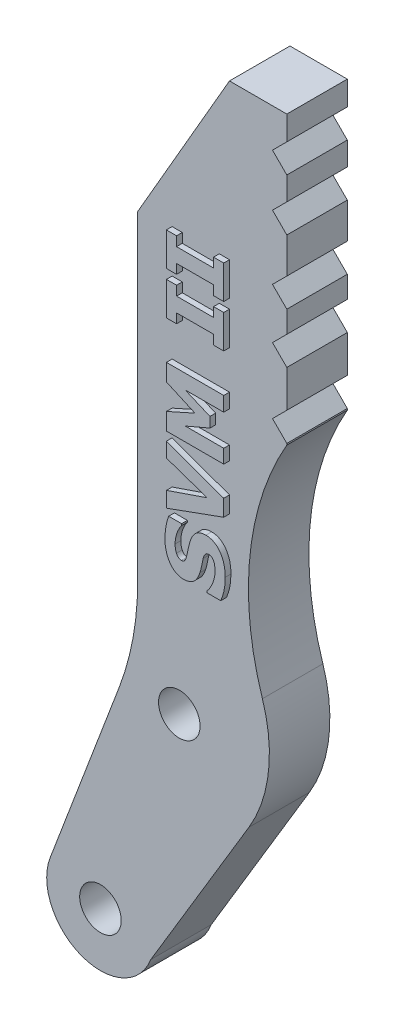
from build123d import *

# Parameters (mm, degrees)
BOSS_EXTRUDE1_DEPTH      = 5.08
BOSS_EXTRUDE1_DEPTH_BACK = 0.278409343
SKETCH1_R                = 1.8415
CUT_EXTRUDE1_DEPTH       = 72.358313291
CUT_EXTRUDE1_DEPTH_BACK  = 72.358313291
FILLET2_R                = 12.7
BOSS_EXTRUDE2_DEPTH      = 0.508
CUT_EXTRUDE3_DEPTH       = 72.358313411
CUT_EXTRUDE3_DEPTH_BACK  = 72.358313411
FILLET3_R                = 25.4


with BuildPart() as part:
    # Sketch1 → Boss-Extrude1 (new, two sides: drawn at the far end of the back side and taken through both)
    with BuildSketch(Plane.XY.offset(-BOSS_EXTRUDE1_DEPTH_BACK)):
        with BuildLine():
            Line((-1.208443772, 47.324573258), (-1.208443772, 10.242675014))
            Line((-1.208443772, 10.242675014), (-4.452925719, 1.68904079))
            ThreePointArc((-4.452925719, 1.68904079), (-1.68904079, -4.452925719), (4.452925719, -1.68904079))
            Line((4.452925719, -1.68904079), (16.51, 18.415))
            ThreePointArc((16.51, 18.415), (13.107045256, 31.115), (16.51, 43.815))
            Line((16.51, 43.815), (16.51, 69.215))
            Line((16.51, 69.215), (11.43, 69.215))
            Line((11.43, 69.215), (-1.208443772, 47.324573258))
        make_face()
        Circle(SKETCH1_R, mode=Mode.SUBTRACT)
        with Locations((6.985, 18.415)):
            Circle(SKETCH1_R, mode=Mode.SUBTRACT)
    extrude(amount=BOSS_EXTRUDE1_DEPTH + BOSS_EXTRUDE1_DEPTH_BACK)

    # Sketch2 → Cut-Extrude1 (cut, two sides: drawn at the far end of the back side and taken through both)
    with BuildSketch(Plane(origin=(0, 0, -0.278409343), x_dir=(-1, 0, 0), z_dir=(0, 0, -1)).offset(-CUT_EXTRUDE1_DEPTH_BACK)):
        Polygon((-16.51, 64.538831006), (-15.24, 65.808831006), (-16.51, 67.078831006), align=None)
        Polygon((-16.51, 62.474619372), (-16.51, 59.934619372), (-15.24, 61.204619372), align=None)
        Polygon((-15.24, 55.512601826), (-16.51, 56.782601826), (-16.51, 54.242601826), align=None)
        Polygon((-16.51, 49.774619372), (-15.24, 51.044619372), (-16.51, 52.314619372), align=None)
        Polygon((-16.51, 43.946372647), (-15.24, 45.216372647), (-16.51, 46.486372647), align=None)
    extrude(amount=CUT_EXTRUDE1_DEPTH + CUT_EXTRUDE1_DEPTH_BACK, mode=Mode.SUBTRACT)

    # Fillet2
    fillet2_edges = [part.edges().sort_by_distance(p)[0] for p in [
        (16.51, 18.415, 2.400795328),
        (-1.208443772, 10.242675014, 2.400795328),
    ]]
    fillet(fillet2_edges, radius=FILLET2_R)

    # Sketch3 → Boss-Extrude2 (add)
    with BuildSketch(Plane.XY.offset(5.08)):
        Polygon((11.43, 55.499774955), (11.43, 52.541800271), (10.529746835, 52.541800271), (10.529746835, 53.377749638), (7.250253165, 53.377749638), (7.250253165, 52.541800271), (6.35, 52.541800271), (6.35, 55.499774955), (7.250253165, 55.499774955), (7.250253165, 54.663825588), (10.529746835, 54.663825588), (10.529746835, 55.499774955), align=None)
        Polygon((11.43, 51.705850904), (11.43, 48.747876221), (10.529746835, 48.747876221), (10.529746835, 49.583825588), (7.250253165, 49.583825588), (7.250253165, 48.747876221), (6.35, 48.747876221), (6.35, 51.705850904), (7.250253165, 51.705850904), (7.250253165, 50.869901537), (10.529746835, 50.869901537), (10.529746835, 51.705850904), align=None)
        Polygon((11.43, 45.339774955), (11.43, 44.053699005), (8.016875, 44.053699005), (10.208227848, 43.119284449), (10.208227848, 42.223050271), (8.016875, 41.288635714), (11.43, 41.288635714), (11.43, 40.066863562), (6.35, 40.066863562), (6.35, 41.572979069), (8.879952532, 42.706333499), (6.35, 43.836673689), (6.35, 45.339774955), align=None)
        Polygon((6.35, 39.295217993), (11.43, 37.452512297), (11.43, 35.993619892), (6.35, 34.150914195), (6.35, 35.519379385), (9.96306962, 36.757227486), (6.35, 37.995075588), align=None)
        with BuildLine():
            add(Edge.make_bspline(
                [(9.846518987, 33.829395208), (9.908602777, 33.827540047), (10.030514618, 33.82389713), (10.208713746, 33.792945029), (10.37755686, 33.742396865), (10.538147756, 33.672998198), (10.688740624, 33.581082418), (10.830778166, 33.470272153), (10.963579449, 33.338826792), (11.085932635, 33.18864266), (11.197929538, 33.021963025), (11.293997733, 32.838956956), (11.376625705, 32.642412012), (11.444249411, 32.431368692), (11.494587867, 32.205538816), (11.531330238, 31.965874182), (11.555385035, 31.712212514), (11.557515563, 31.538294184), (11.558607595, 31.449149955)],
                knots=[0, 0, 0, 0, 0.907462679, 1.781953809, 2.635804048, 3.480274448, 4.332887508, 5.208817748, 6.109340518, 7.059474472, 8.037577805, 9.041105121, 10.077237313, 11.152245627, 12.27748741, 13.457227022, 14.696666784, 16, 16, 16, 16], degree=3))
            add(Edge.make_bspline(
                [(11.558607595, 31.449149955), (11.557222534, 31.346636342), (11.554540117, 31.148100486), (11.534963162, 30.860188018), (11.500015319, 30.592803934), (11.451421038, 30.343998376), (11.390294148, 30.110099901), (11.324729444, 29.884886008), (11.250328749, 29.667396357), (11.194441826, 29.526523276), (11.166756329, 29.45673698)],
                knots=[0, 0, 0, 0, 1.203182053, 2.33017619, 3.384818652, 4.366208123, 5.30340534, 6.221361684, 7.118890722, 8, 8, 8, 8], degree=3))
            Line((11.166756329, 29.45673698), (9.951012658, 29.45673698))
            Line((9.951012658, 29.45673698), (9.951012658, 29.601420524))
            add(Edge.make_bspline(
                [(9.951012658, 29.601420524), (10.005925562, 29.670791142), (10.115428983, 29.809125109), (10.256061384, 30.034014578), (10.37661031, 30.270692385), (10.477327542, 30.516482783), (10.557368735, 30.765472302), (10.614615544, 31.01282093), (10.652175252, 31.255085257), (10.656318563, 31.415528), (10.65835443, 31.494363562)],
                knots=[0, 0, 0, 0, 1.030738938, 2.055426519, 3.085610749, 4.123842265, 5.148648843, 6.130724483, 7.081507926, 8, 8, 8, 8], degree=3))
            add(Edge.make_bspline(
                [(10.65835443, 31.494363562), (10.658286547, 31.516143707), (10.658141214, 31.562773303), (10.652039486, 31.637076265), (10.645415149, 31.720871995), (10.635560088, 31.811011065), (10.623653992, 31.902104015), (10.606321923, 31.986833284), (10.587418857, 32.063377016), (10.568770287, 32.109437552), (10.559889241, 32.131373056)],
                knots=[0, 0, 0, 0, 0.806557331, 1.726776592, 2.760222249, 3.920734434, 5.085813889, 6.161303184, 7.124353598, 8, 8, 8, 8], degree=3))
            add(Edge.make_bspline(
                [(10.559889241, 32.131373056), (10.548278749, 32.155719314), (10.525461663, 32.203564893), (10.484483167, 32.269671811), (10.438417088, 32.328362177), (10.389578607, 32.382044816), (10.331125761, 32.427070095), (10.259639825, 32.458406664), (10.175922166, 32.476002082), (10.11621397, 32.477973237), (10.084643987, 32.479015461)],
                knots=[0, 0, 0, 0, 1.025060442, 2.01446193, 2.949256246, 3.85908539, 4.768290539, 5.73153362, 6.800575992, 8, 8, 8, 8], degree=3))
            add(Edge.make_bspline(
                [(10.084643987, 32.479015461), (10.056927125, 32.477396752), (10.002427609, 32.474213893), (9.924421697, 32.444907083), (9.852925178, 32.398648645), (9.788235894, 32.333930836), (9.731427695, 32.252001084), (9.679477368, 32.154587918), (9.637368581, 32.039218536), (9.615088031, 31.956068485), (9.603370253, 31.912338246)],
                knots=[0, 0, 0, 0, 0.825786558, 1.623739628, 2.456775365, 3.355767579, 4.339087636, 5.42728423, 6.646958453, 8, 8, 8, 8], degree=3))
            add(Edge.make_bspline(
                [(9.603370253, 31.912338246), (9.580728215, 31.812306031), (9.534259437, 31.607007601), (9.474361461, 31.295017625), (9.411641088, 30.983266348), (9.350101078, 30.782590863), (9.320031646, 30.684537613)],
                knots=[0, 0, 0, 0, 0.976116373, 2.003306214, 3.02438349, 4, 4, 4, 4], degree=3))
            add(Edge.make_bspline(
                [(9.320031646, 30.684537613), (9.302062657, 30.631799329), (9.267084338, 30.529139319), (9.208528019, 30.381862042), (9.142233442, 30.247579211), (9.075052468, 30.1227563), (8.999939518, 30.011299627), (8.921669681, 29.910019022), (8.838410616, 29.819985914), (8.749135484, 29.742490008), (8.655914028, 29.674192108), (8.556944676, 29.615719983), (8.452229808, 29.56653963), (8.342275409, 29.526284101), (8.226996985, 29.494847486), (8.106231678, 29.473504097), (7.980082532, 29.458330351), (7.894008622, 29.457275333), (7.850087025, 29.45673698)],
                knots=[0, 0, 0, 0, 1.287139616, 2.505537848, 3.65787682, 4.745319116, 5.777517297, 6.75878323, 7.700384896, 8.605120322, 9.485712598, 10.366814604, 11.256335458, 12.154696155, 13.068779358, 14.012730507, 14.985940713, 16, 16, 16, 16], degree=3))
            add(Edge.make_bspline(
                [(7.850087025, 29.45673698), (7.791354794, 29.45863184), (7.675770813, 29.462360891), (7.506656487, 29.492914561), (7.346696491, 29.545061294), (7.194136165, 29.615488362), (7.051171595, 29.708325001), (6.915155287, 29.819684841), (6.788536486, 29.952288601), (6.671765744, 30.103943209), (6.566162416, 30.270915063), (6.472857681, 30.450442523), (6.396330151, 30.642408171), (6.331243615, 30.844586323), (6.282861924, 31.058931477), (6.246307375, 31.284329576), (6.225326954, 31.521761783), (6.222722159, 31.683885472), (6.221392405, 31.766649955)],
                knots=[0, 0, 0, 0, 0.894901293, 1.761149761, 2.608783409, 3.453876344, 4.314933854, 5.200038827, 6.12799933, 7.103249695, 8.113098521, 9.136064399, 10.182719798, 11.259667356, 12.370545059, 13.528828137, 14.738461593, 16, 16, 16, 16], degree=3))
            add(Edge.make_bspline(
                [(6.221392405, 31.766649955), (6.222528011, 31.8514178), (6.224797298, 32.020809761), (6.243874818, 32.273888868), (6.272505629, 32.525416498), (6.313500361, 32.772820651), (6.364781065, 33.010774592), (6.420124995, 33.23543647), (6.483113198, 33.442652982), (6.531581627, 33.573397614), (6.554968354, 33.636483816)],
                knots=[0, 0, 0, 0, 1.065384654, 2.128962885, 3.18847586, 4.246683315, 5.279600907, 6.247539799, 7.154412252, 8, 8, 8, 8], degree=3))
            Line((6.554968354, 33.636483816), (7.700379747, 33.636483816))
            Line((7.700379747, 33.636483816), (7.700379747, 33.492805018))
            add(Edge.make_bspline(
                [(7.700379747, 33.492805018), (7.659783181, 33.438268259), (7.576934778, 33.326971078), (7.470049878, 33.141615983), (7.371919355, 32.939764244), (7.284069421, 32.72296597), (7.211977534, 32.495722773), (7.159682215, 32.263193596), (7.127219926, 32.028136055), (7.123504109, 31.87057558), (7.12164557, 31.791768626)],
                knots=[0, 0, 0, 0, 0.892231706, 1.82084296, 2.804411717, 3.838445872, 4.890103822, 5.931567007, 6.965432763, 8, 8, 8, 8], degree=3))
            add(Edge.make_bspline(
                [(7.12164557, 31.791768626), (7.122897727, 31.736130515), (7.12540856, 31.624564676), (7.142857323, 31.458174383), (7.177386255, 31.293929186), (7.218590445, 31.19044593), (7.239200949, 31.138683183)],
                knots=[0, 0, 0, 0, 0.99896713, 2.003134239, 3.001159596, 4, 4, 4, 4], degree=3))
            add(Edge.make_bspline(
                [(7.239200949, 31.138683183), (7.249421635, 31.11665094), (7.26985619, 31.07260115), (7.30944928, 31.011239752), (7.356045072, 30.954364399), (7.409550916, 30.903333486), (7.469549145, 30.861467184), (7.533692811, 30.828890238), (7.602929834, 30.810631275), (7.650379065, 30.808293257), (7.674256329, 30.807116727)],
                knots=[0, 0, 0, 0, 1.005120364, 2.009570296, 3.014977851, 4.045438181, 5.061509448, 6.035608779, 7.011484765, 8, 8, 8, 8], degree=3))
            add(Edge.make_bspline(
                [(7.674256329, 30.807116727), (7.706663221, 30.808884279), (7.768589843, 30.812261909), (7.855645615, 30.842741777), (7.929971678, 30.893423372), (7.980415755, 30.952000788), (8.015912754, 31.008743324), (8.04157892, 31.061601604), (8.067660805, 31.122533716), (8.092512029, 31.192508113), (8.117609581, 31.270492965), (8.14172281, 31.357306242), (8.164560427, 31.452942682), (8.179096945, 31.519789938), (8.186677215, 31.554648373)],
                knots=[0, 0, 0, 0, 1.174343879, 2.244064321, 3.303704314, 4.407076671, 5.02483983, 5.732197225, 6.53898402, 7.431906431, 8.428480183, 9.514816237, 10.704066255, 12, 12, 12, 12], degree=3))
            add(Edge.make_bspline(
                [(8.186677215, 31.554648373), (8.205783138, 31.647752537), (8.243256156, 31.830360525), (8.299300303, 32.104837469), (8.365485729, 32.383998784), (8.423011231, 32.570758359), (8.452935127, 32.667907866)],
                knots=[0, 0, 0, 0, 0.995794372, 1.953081347, 2.935223864, 4, 4, 4, 4], degree=3))
            add(Edge.make_bspline(
                [(8.452935127, 32.667907866), (8.469158427, 32.715989594), (8.500893822, 32.810045214), (8.555997599, 32.944234154), (8.616041355, 33.068651871), (8.678165957, 33.184367713), (8.747339934, 33.289191958), (8.819340354, 33.384941588), (8.895843829, 33.471157458), (8.977903749, 33.546805286), (9.064806137, 33.614267777), (9.158768462, 33.670910051), (9.257785953, 33.721030096), (9.363472, 33.761244263), (9.47578887, 33.790935788), (9.593994583, 33.812915845), (9.718208291, 33.827709256), (9.80327134, 33.828826951), (9.846518987, 33.829395208)],
                knots=[0, 0, 0, 0, 1.237247399, 2.420255609, 3.534416354, 4.605351393, 5.620193117, 6.593738998, 7.524982051, 8.426564095, 9.311945829, 10.20281032, 11.097671666, 12.01534975, 12.954438892, 13.926750701, 14.945921247, 16, 16, 16, 16], degree=3))
        make_face()
    extrude(amount=BOSS_EXTRUDE2_DEPTH)

    # Sketch4 → Cut-Extrude3 (cut, two sides: drawn at the far end of the back side and taken through both)
    with BuildSketch(Plane.XY.offset(5.08).offset(-CUT_EXTRUDE3_DEPTH_BACK)):
        Polygon((3.302, 55.136891036), (-1.208443772, 55.136891036), (-1.208443772, 24.765), (-11.75715794, 6.547853275), (-4.452925719, 1.68904079), (2.532074281, 20.10404079), (3.302, 22.133844959), align=None)
    extrude(amount=CUT_EXTRUDE3_DEPTH + CUT_EXTRUDE3_DEPTH_BACK, mode=Mode.SUBTRACT)

    # Fillet3
    fillet3_edges = [part.edges().sort_by_distance(p)[0] for p in [
        (3.302, 22.133844959, 2.400795328),
    ]]
    fillet(fillet3_edges, radius=FILLET3_R)


solid = part.part
